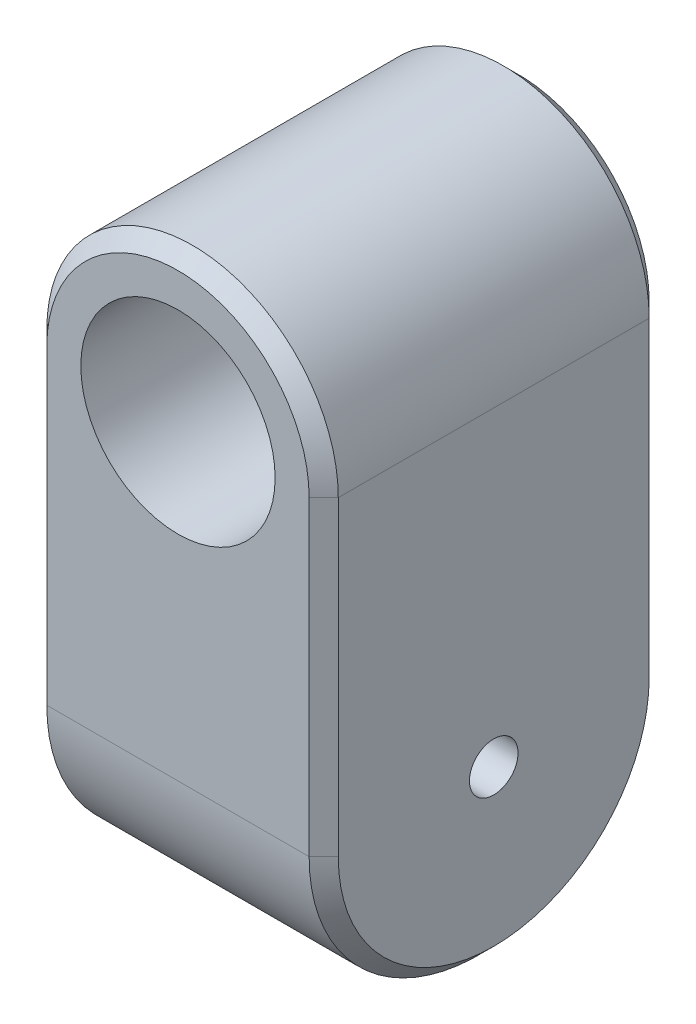
from build123d import *

# Parameters (mm, degrees)
SKETCH1_R                       = 12.5
BOSS_EXTRUDE1_DEPTH             = 75
BOSS_EXTRUDE2_REACH             = 161.315
SKETCH2_R                       = 50
BOSS_EXTRUDE2_DIRECTION_2_REACH = 161.315
CHAMFER1_SIZE                   = 7.5


with BuildPart() as part:
    # Sketch1 → Boss-Extrude1 (new, symmetric)
    with BuildSketch(Plane(origin=(0, 0, 0), x_dir=(0, 0, -1), z_dir=(1, 0, 0))):
        with BuildLine():
            Line((-87.5, 0), (-87.5, 110))
            Line((-87.5, 110), (87.5, 110))
            Line((87.5, 110), (87.5, 0))
            ThreePointArc((87.5, 0), (0, -87.5), (-87.5, 0))
        make_face()
        Circle(SKETCH1_R, mode=Mode.SUBTRACT)
    extrude(amount=BOSS_EXTRUDE1_DEPTH, both=True)

    # Boss-Extrude2: up to this face of the body (flat: up to its plane)
    boss_extrude2_end = Plane(part.part.faces().sort_by_distance((0, 55, 87.5))[0])
    # Sketch2 → Boss-Extrude2 (add, up to the picked face)
    with BuildSketch(Plane.XY, mode=Mode.PRIVATE) as boss_extrude2_sk1:
        with BuildLine():
            Line((-75, 160), (-75, 85))
            Line((-75, 85), (75, 85))
            Line((75, 85), (75, 160))
            ThreePointArc((75, 160), (0, 235), (-75, 160))
        make_face()
        with Locations(Location((0, 160, 0), (0, 0, 180))):
            Circle(SKETCH2_R, mode=Mode.SUBTRACT)
    boss_extrude2_tool1 = split(extrude(boss_extrude2_sk1.sketch, amount=BOSS_EXTRUDE2_REACH, mode=Mode.PRIVATE), bisect_by=boss_extrude2_end, keep=Keep.BOTH, mode=Mode.PRIVATE)
    add(boss_extrude2_tool1.solids().sort_by(Axis((-72.87868, 122.5, 0), (0, 0, 1)))[0])

    # Boss-Extrude2 direction 2: up to this face of the body (flat: up to its plane)
    boss_extrude2_direction_2_end = Plane(part.part.faces().sort_by_distance((0, 55, -87.5))[0])
    # Sketch2 → Boss-Extrude2 direction 2 (add, up to the picked face)
    with BuildSketch(Plane.XY, mode=Mode.PRIVATE) as boss_extrude2_direction_2_sk1:
        with BuildLine():
            Line((-75, 160), (-75, 85))
            Line((-75, 85), (75, 85))
            Line((75, 85), (75, 160))
            ThreePointArc((75, 160), (0, 235), (-75, 160))
        make_face()
        with Locations(Location((0, 160, 0), (0, 0, 180))):
            Circle(SKETCH2_R, mode=Mode.SUBTRACT)
    boss_extrude2_direction_2_tool1 = split(extrude(boss_extrude2_direction_2_sk1.sketch, amount=-BOSS_EXTRUDE2_DIRECTION_2_REACH, mode=Mode.PRIVATE), bisect_by=boss_extrude2_direction_2_end, keep=Keep.BOTH, mode=Mode.PRIVATE)
    add(boss_extrude2_direction_2_tool1.solids().sort_by(Axis((-72.87868, 122.5, 0), (0, 0, -1)))[0])

    # Chamfer1
    chamfer1_edges = [part.edges().sort_by_distance(p)[0] for p in [
        (75, 80, 87.5),
        (0, 235, -87.5),
        (0, 235, 87.5),
        (75, -87.5, 0),
        (-75, 80, 87.5),
        (-75, 80, -87.5),
        (-75, -87.5, 0),
        (75, 80, -87.5),
    ]]
    chamfer(chamfer1_edges, length=CHAMFER1_SIZE)


solid = part.part
